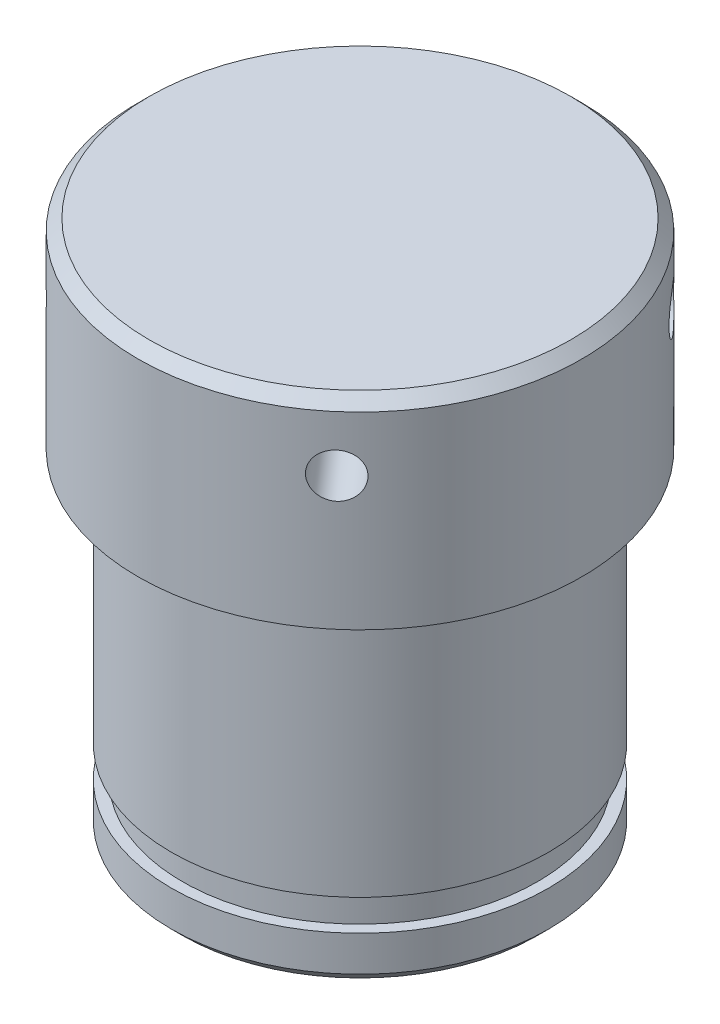
from build123d import *

# Parameters (mm, degrees)
SKETCH_1_R               = 8.5
EXTRUDE_1_DEPTH          = 15
SKETCH_2_R               = 10
EXTRUDE_2_DEPTH          = 9
SKETCH_3_R               = 1
CUT_EXTRUDE_1_DEPTH      = 10
CUT_EXTRUDE_START        = -2.1
SKETCH_4_R               = 8.5
SKETCH_4_R_2             = 8
CUT_EXTRUDE_2_DEPTH      = 1.4
CHAMFER_1_SIZE           = 0.5
SKETCH_7_R               = 1
CUT_EXTRUDE_3_DEPTH      = 8
PATTERN_CIRCULAR_1_COUNT = 4


with BuildPart() as part:
    # Эскиз1 → Бобышка-Вытянуть1 (new body)
    with BuildSketch(Plane(origin=(0, 0, 0), x_dir=(1, 0, 0), z_dir=(0, 1, 0))):
        with Locations(Location((0, 0, 0), (0, 0, 270))):
            Circle(SKETCH_1_R)
    extrude(amount=EXTRUDE_1_DEPTH)

    # Эскиз2 → Бобышка-Вытянуть2 (add)
    with BuildSketch(Plane(origin=(0, 15, 0), x_dir=(1, 0, 0), z_dir=(0, 1, 0))):
        with Locations(Location((0, 0, 0), (0, 0, 270))):
            Circle(SKETCH_2_R)
    extrude(amount=EXTRUDE_2_DEPTH)

    # Эскиз3 → Вырез-Вытянуть1 (cut)
    with BuildSketch(Plane.XZ):
        with Locations(Location((0, 6, 0), (0, 0, 270))):
            Circle(SKETCH_3_R)
        with Locations(Location((6, 0, 0), (0, 0, 270))):
            Circle(SKETCH_3_R)
        with Locations(Location((0, -6, 0), (0, 0, 270))):
            Circle(SKETCH_3_R)
        with Locations(Location((-6, 0, 0), (0, 0, 270))):
            Circle(SKETCH_3_R)
    extrude(amount=-CUT_EXTRUDE_1_DEPTH, mode=Mode.SUBTRACT)

    # Эскиз4 → Вырез-Вытянуть2 (cut)
    with BuildSketch(Plane.XZ.offset(CUT_EXTRUDE_START)):
        with Locations(Location((0, 0, 0), (0, 0, 270))):
            Circle(SKETCH_4_R)
        with Locations(Location((0, 0, 0), (0, 0, 270))):
            Circle(SKETCH_4_R_2, mode=Mode.SUBTRACT)
    extrude(amount=-CUT_EXTRUDE_2_DEPTH, mode=Mode.SUBTRACT)

    # Фаска1
    chamfer_1_edges = [part.edges().sort_by_distance(p)[0] for p in [
        (0, 0, -8.5),
        (0, 24, -10),
    ]]
    chamfer(chamfer_1_edges, length=CHAMFER_1_SIZE)

    # Эскиз7 → Вырез-Вытянуть3 (cut)
    with BuildSketch(Plane(origin=(6.524591557, 0, 7.578238913), x_dir=(0.7578238912515232, 0, -0.6524591556935956), z_dir=(0.6524591556935956, 0, 0.7578238912515232))):
        with Locations((0, 21)):
            Circle(SKETCH_7_R)
    cut_extrude_3 = extrude(amount=-CUT_EXTRUDE_3_DEPTH, mode=Mode.SUBTRACT)

    # Круговой массив1: Вырез-Вытянуть3 ×4 about axis
    pattern_circular_1_axis = Axis((0, 0, 0), (0, 1, 0))
    for i in range(1, PATTERN_CIRCULAR_1_COUNT):
        add(cut_extrude_3.rotate(pattern_circular_1_axis, i * 360 / PATTERN_CIRCULAR_1_COUNT), mode=Mode.SUBTRACT)


solid = part.part
